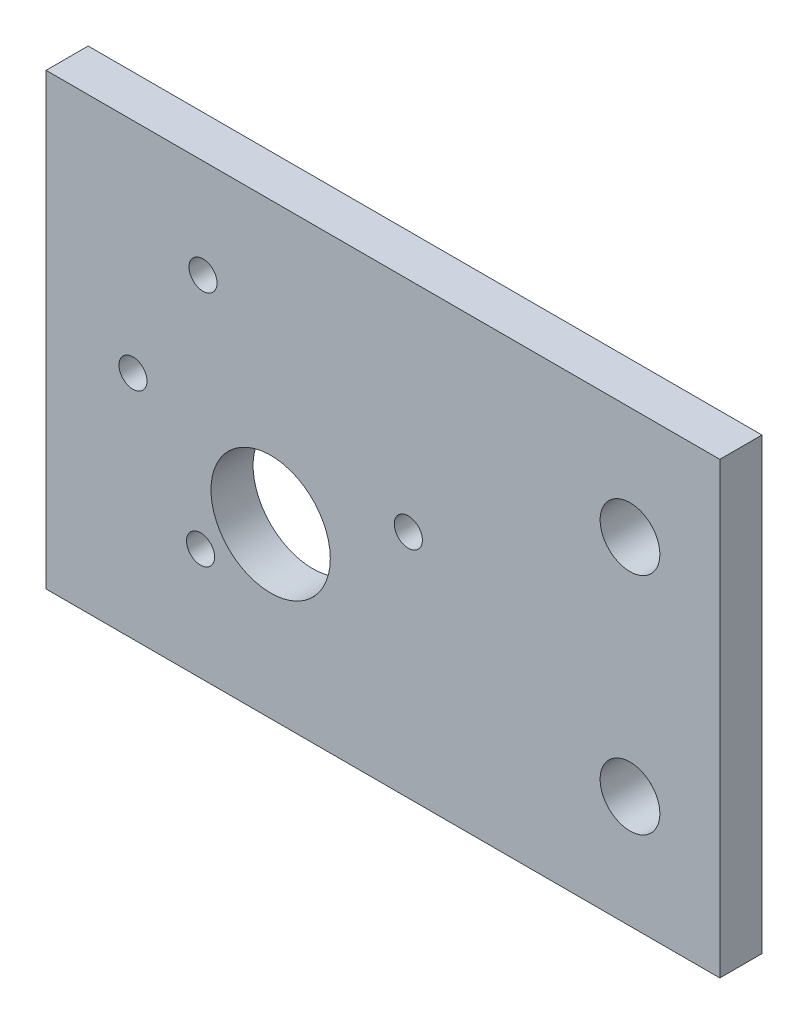
from build123d import *

# Parameters (mm, degrees)
SKETCH1_W                        = 76.2
SKETCH1_H                        = 50.8
BOSS_EXTRUDE1_DEPTH              = 4.7625
F_17_32_0_53125_DIAMETER_HOLE1_D = 13.49375
F_1_8_0_125_DIAMETER_HOLE1_D     = 3.175
H_0_266_DIAMETER_HOLE1_D         = 6.7564


with BuildPart() as part:
    # Sketch1 → Boss-Extrude1 (new body)
    with BuildSketch(Plane.XY):
        Rectangle(SKETCH1_W, SKETCH1_H)
    extrude(amount=BOSS_EXTRUDE1_DEPTH)

    # 17/32 (0.53125) Diameter Hole1 (through all)
    with Locations(Plane.XY.offset(4.7625)):
        with Locations((-12.7, -6.35)):
            Hole(F_17_32_0_53125_DIAMETER_HOLE1_D / 2)

    # 1/8 (0.125) Diameter Hole1 (through all)
    with Locations(Plane.XY.offset(4.7625)):
        with Locations((-20.3454, 14.22428539), (-28.2702, 0.6604), (-20.6248, -12.74216218), (2.8702, 0.6604)):
            Hole(F_1_8_0_125_DIAMETER_HOLE1_D / 2)

    # H (0.266) Diameter Hole1 (through all)
    with Locations(Plane.XY.offset(4.7625)):
        with Locations((27.94, 12.7), (27.94, -12.7)):
            Hole(H_0_266_DIAMETER_HOLE1_D / 2)


solid = part.part
